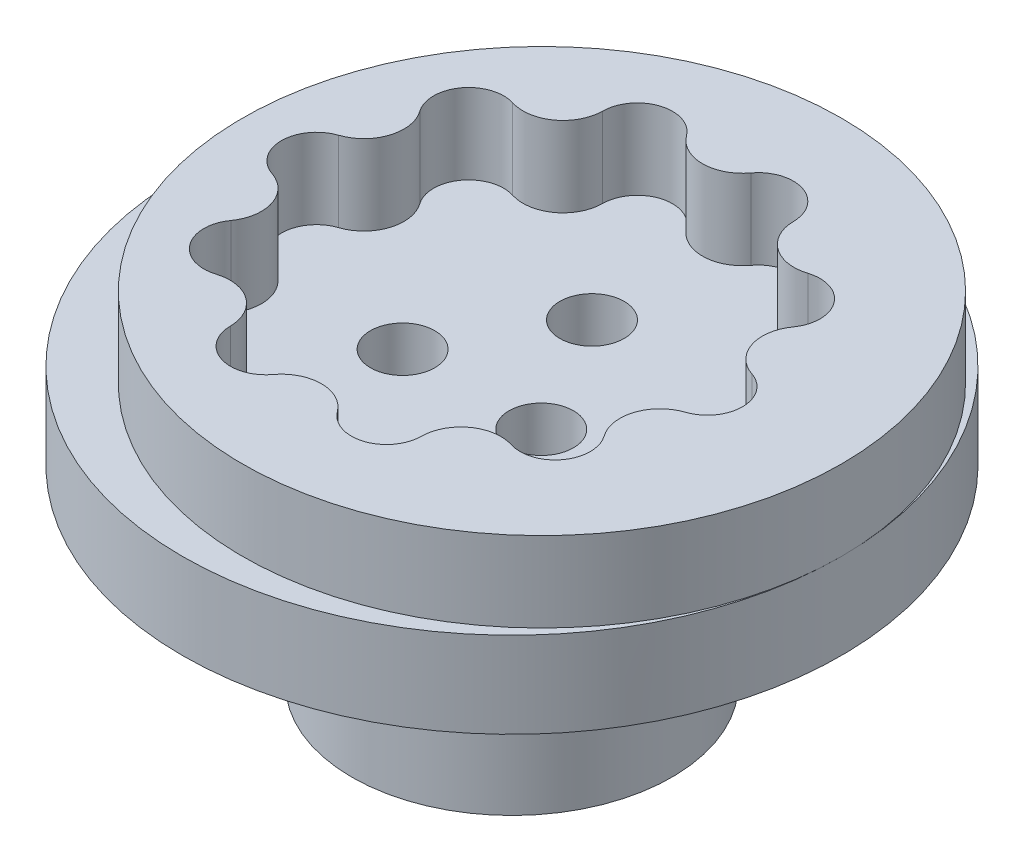
from build123d import *

# Parameters (mm, degrees)
SKETCH1_R               = 26.14295
BOSS_EXTRUDE1_DEPTH     = 6.810375
SKETCH2_R               = 12.7
BOSS_EXTRUDE2_DEPTH     = 15.08125
BOSS_EXTRUDE3_START     = 6.35
SKETCH3_R               = 26.14295
BOSS_EXTRUDE3_DEPTH     = 6.35
F_1_4_20_TAPPED_HOLE1_D = 5.1054
SKETCH6_W               = 66.50359939
SKETCH6_H               = 67.616646228
CUT_EXTRUDE2_DEPTH      = 6.35


with BuildPart() as part:
    # Sketch1 → Boss-Extrude1 (new body)
    with BuildSketch(Plane(origin=(0, 0, 0), x_dir=(1, 0, 0), z_dir=(0, 1, 0))):
        with Locations(Location((0, 0, 0), (0, 0, 270))):
            Circle(SKETCH1_R)
    extrude(amount=-BOSS_EXTRUDE1_DEPTH)

    # Sketch2 → Boss-Extrude2 (add)
    with BuildSketch(Plane.XZ.offset(6.810375)):
        with Locations(Location((0, 0, 0), (0, 0, 90))):
            Circle(SKETCH2_R)
    extrude(amount=BOSS_EXTRUDE2_DEPTH)

    # Sketch3 → Boss-Extrude3 (add)
    with BuildSketch(Plane(origin=(0, 0, 0), x_dir=(1, 0, 0), z_dir=(0, 1, 0)).offset(BOSS_EXTRUDE3_START)):
        with Locations(Location((0, 0, 0), (0, 0, 270))):
            Circle(SKETCH3_R)
        with BuildLine():
            ThreePointArc((2.553003524, 16.40046245), (5.651302793, 17.39292157), (7.574526721, 14.768870658))
            ThreePointArc((7.574526721, 14.768870658), (7.926495509, 13.34211974), (8.883198518, 12.226673836))
            ThreePointArc((8.883198518, 12.226673836), (10.239688102, 11.661486946), (11.705373197, 11.767635017))
            ThreePointArc((11.705373197, 11.767635017), (14.795302793, 10.749416694), (14.808845207, 7.496072251))
            ThreePointArc((14.808845207, 7.496072251), (14.25497079, 6.134924448), (14.373317131, 4.670173836))
            ThreePointArc((14.373317131, 4.670173836), (15.138531738, 3.415603465), (16.386688159, 2.639970974))
            ThreePointArc((16.386688159, 2.639970974), (18.288, 0), (16.386688159, -2.639970974))
            ThreePointArc((16.386688159, -2.639970974), (15.138531738, -3.415603465), (14.373317131, -4.670173836))
            ThreePointArc((14.373317131, -4.670173836), (14.25497079, -6.134924448), (14.808845207, -7.496072251))
            ThreePointArc((14.808845207, -7.496072251), (14.795302793, -10.749416694), (11.705373197, -11.767635017))
            ThreePointArc((11.705373197, -11.767635017), (10.239688102, -11.661486946), (8.883198518, -12.226673836))
            ThreePointArc((8.883198518, -12.226673836), (7.926495509, -13.34211974), (7.574526721, -14.768870658))
            ThreePointArc((7.574526721, -14.768870658), (5.651302793, -17.39292157), (2.553003524, -16.40046245))
            ThreePointArc((2.553003524, -16.40046245), (1.429631644, -15.453078773), (0, -15.113))
            ThreePointArc((0, -15.113), (-1.429631644, -15.453078773), (-2.553003524, -16.40046245))
            ThreePointArc((-2.553003524, -16.40046245), (-5.651302793, -17.39292157), (-7.574526721, -14.768870658))
            ThreePointArc((-7.574526721, -14.768870658), (-7.926495509, -13.34211974), (-8.883198518, -12.226673836))
            ThreePointArc((-8.883198518, -12.226673836), (-10.239688102, -11.661486946), (-11.705373197, -11.767635017))
            ThreePointArc((-11.705373197, -11.767635017), (-14.795302793, -10.749416694), (-14.808845207, -7.496072251))
            ThreePointArc((-14.808845207, -7.496072251), (-14.25497079, -6.134924448), (-14.373317131, -4.670173836))
            ThreePointArc((-14.373317131, -4.670173836), (-15.138531738, -3.415603465), (-16.386688159, -2.639970974))
            ThreePointArc((-16.386688159, -2.639970974), (-18.288, 0), (-16.386688159, 2.639970974))
            ThreePointArc((-16.386688159, 2.639970974), (-15.138531738, 3.415603465), (-14.373317131, 4.670173836))
            ThreePointArc((-14.373317131, 4.670173836), (-14.25497079, 6.134924448), (-14.808845207, 7.496072251))
            ThreePointArc((-14.808845207, 7.496072251), (-14.795302793, 10.749416694), (-11.705373197, 11.767635017))
            ThreePointArc((-11.705373197, 11.767635017), (-10.239688102, 11.661486946), (-8.883198518, 12.226673836))
            ThreePointArc((-8.883198518, 12.226673836), (-7.926495509, 13.34211974), (-7.574526721, 14.768870658))
            ThreePointArc((-7.574526721, 14.768870658), (-5.651302793, 17.39292157), (-2.553003524, 16.40046245))
            ThreePointArc((-2.553003524, 16.40046245), (-1.429631644, 15.453078773), (0, 15.113))
            ThreePointArc((0, 15.113), (1.429631644, 15.453078773), (2.553003524, 16.40046245))
        make_face(mode=Mode.SUBTRACT)
    extrude(amount=-BOSS_EXTRUDE3_DEPTH)

    # 1/4-20 Tapped Hole1 (through all)
    with Locations(Plane(origin=(0, -21.891625, 0), x_dir=(-1, 0, 0), z_dir=(0, -1, 0))):
        with Locations((0, 6.35), (5.499261314, -3.175), (-5.499261314, -3.175)):
            Hole(F_1_4_20_TAPPED_HOLE1_D / 2)

    # Sketch6 → Cut-Extrude2 (cut)
    with BuildSketch(Plane(origin=(0, 6.35, 0), x_dir=(1, 0, 0), z_dir=(0, 1, 0))):
        Rectangle(SKETCH6_W, SKETCH6_H)
        with BuildLine():
            ThreePointArc((26.14295, 0), (2.38125, -23.7617), (-21.38045, 0))
            ThreePointArc((-21.38045, 0), (2.38125, 23.7617), (26.14295, 0))
        make_face(mode=Mode.SUBTRACT)
    extrude(amount=-CUT_EXTRUDE2_DEPTH, mode=Mode.SUBTRACT)


solid = part.part
